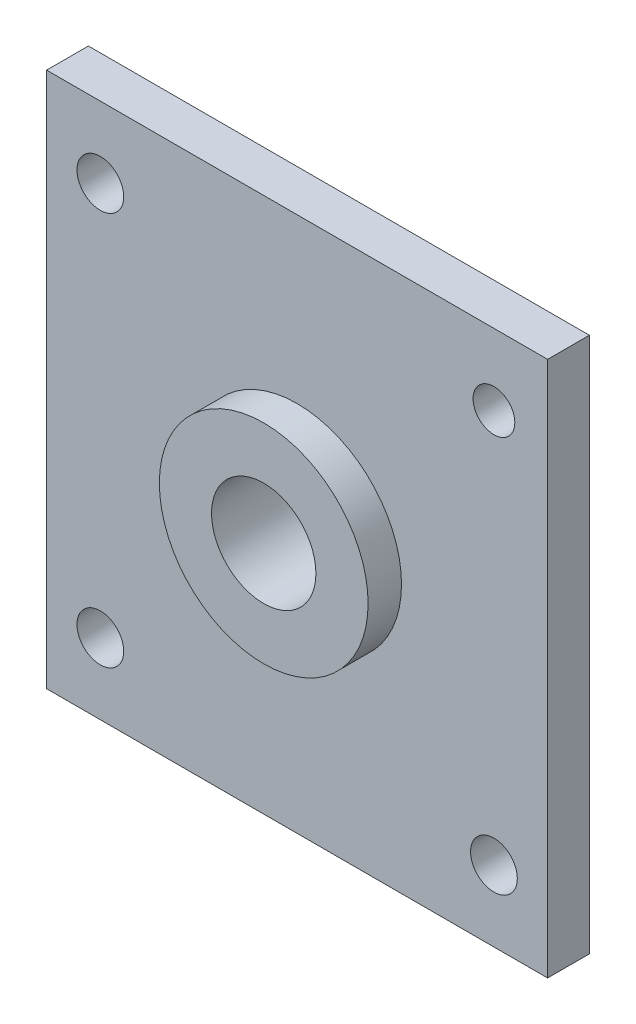
from build123d import *
from OCP.BRepFilletAPI import BRepFilletAPI_MakeChamfer

# Parameters (mm, degrees)
SKETCH_1_W               = 150
SKETCH_1_H               = 150
EXTRUDE_1_DEPTH          = 20
SKETCH_2_W               = 200
SKETCH_2_H               = 170
EXTRUDE_2_DEPTH          = 20
SKETCH_3_W               = 200
SKETCH_3_H               = 22.5
EXTRUDE_3_DEPTH          = 20
SKETCH_4_W               = 200
SKETCH_4_H               = 101.536616744
SKETCH_4_R               = 12
EXTRUDE_4_DEPTH          = 10
SKETCH_5_W               = 200
SKETCH_5_H               = 170
EXTRUDE_5_DEPTH          = 10
SKETCH_6_W               = 12.361111111
SKETCH_6_H               = 120
EXTRUDE_6_DEPTH          = 60
CHAMFER_1_SIZE           = 10
CHAMFER_1_SIZE2          = 12.546778674
SKETCH_8_R               = 12.5
CUT_EXTRUDE_1_DEPTH      = 200
SKETCH_9_R               = 5.6
CUT_EXTRUDE_2_DEPTH      = 200
FILLET_1_R               = 10
SKETCH_10_R              = 40
SKETCH_10_R_2            = 8.532995409
EXTRUDE_7_DEPTH          = 5
SKETCH_11_R              = 12.5
CUT_EXTRUDE_3_DEPTH      = 200
SKETCH_12_W              = 50
SKETCH_12_H              = 12.140710291
EXTRUDE_8_DEPTH          = 120
EXTRUDE_9_DEPTH          = 120
SKETCH_14_R              = 5
SKETCH_14_R_2            = 5.6
CUT_EXTRUDE_4_DEPTH      = 200
CUT_EXTRUDE_5_DEPTH      = 428.663313117
CUT_EXTRUDE_5_DEPTH_BACK = 428.663313117
SKETCH_16_W              = 64.88929467
SKETCH_16_H              = 154.650571828
SKETCH_17_R              = 25
SKETCH_17_R_2            = 12.5
EXTRUDE_11_DEPTH         = 8
RIB_1_REACH              = 411.018
SKETCH_18_WALL_W         = 895.028437604
SKETCH_18_WALL_H         = 15
CUT_EXTRUDE_6_DEPTH      = 428.663313117
CUT_EXTRUDE_6_DEPTH_BACK = 428.663313117
CUT_EXTRUDE_7_DEPTH      = 390.123413038
CUT_EXTRUDE_7_DEPTH_BACK = 390.123413038
SKETCH_20_W              = 77.763891656
SKETCH_20_H              = 49.195078016
CUT_EXTRUDE_8_DEPTH      = 361.312364484
CUT_EXTRUDE_8_DEPTH_BACK = 361.312364484
SKETCH_21_OUTSIDE_W      = 157.88
SKETCH_21_OUTSIDE_H      = 170.021
SKETCH_21_OUTSIDE_W_2    = 120.000001731
SKETCH_21_OUTSIDE_H_2    = 128.334009182
CUT_EXTRUDE_9_DEPTH      = 361.312364484
CUT_EXTRUDE_9_DEPTH_BACK = 361.312364484
SKETCH_22_R              = 12.5


with BuildPart() as part:
    # 草图1 → 凸台-拉伸1 (new body)
    with BuildSketch(Plane(origin=(0, 0, 0), x_dir=(1, 0, 0), z_dir=(0, 1, 0))):
        Rectangle(SKETCH_1_W, SKETCH_1_H)
    extrude(amount=EXTRUDE_1_DEPTH)

    # 草图2 → 凸台-拉伸2 (add)
    with BuildSketch(Plane(origin=(0, 20, 0), x_dir=(1, 0, 0), z_dir=(0, 1, 0))):
        with Locations((-25, 0)):
            Rectangle(SKETCH_2_W, SKETCH_2_H)
    extrude(amount=-EXTRUDE_2_DEPTH)

    # 草图3 → 凸台-拉伸3 (add)
    with BuildSketch(Plane(origin=(0, 20, 0), x_dir=(1, 0, 0), z_dir=(0, 1, 0))):
        with Locations((-25, -96.25)):
            Rectangle(SKETCH_3_W, SKETCH_3_H)
    extrude(amount=-EXTRUDE_3_DEPTH)

    # 草图4 → 凸台-拉伸4 (add)
    with BuildSketch(Plane(origin=(0, 20, 0), x_dir=(1, 0, 0), z_dir=(0, 1, 0))):
        with Locations((-25, -135.768308372)):
            Rectangle(SKETCH_4_W, SKETCH_4_H)
        with Locations(Location((35, -147.018308372, 0), (0, 0, 270))):
            Circle(SKETCH_4_R, mode=Mode.SUBTRACT)
        with Locations(Location((-85, -147.018308372, 0), (0, 0, 270))):
            Circle(SKETCH_4_R, mode=Mode.SUBTRACT)
    extrude(amount=EXTRUDE_4_DEPTH)

    # 草图5 → 凸台-拉伸5 (add)
    with BuildSketch(Plane(origin=(0, 20, 0), x_dir=(1, 0, 0), z_dir=(0, 1, 0))):
        with Locations((-25, 0)):
            Rectangle(SKETCH_5_W, SKETCH_5_H)
    extrude(amount=EXTRUDE_5_DEPTH)

    # 草图6 → 凸台-拉伸6 (add, symmetric)
    with BuildSketch(Plane(origin=(-25, 0, 0), x_dir=(0, 0, -1), z_dir=(1, 0, 0))):
        Polygon((-67.5, 30), (-5, 30), (-42.777777778, 230), (-67.5, 230), align=None)
        with Locations((-61.319444445, 290)):
            Rectangle(SKETCH_6_W, SKETCH_6_H)
    extrude(amount=EXTRUDE_6_DEPTH, both=True)

    # 倒角1: one chamfer whose edges measure the first distance from different faces: ONE call of the kernel's chamfer builder (chamfer() names one face for all edges)
    chamfer_1_edges_1 = [part.edges().sort_by_distance(p)[0] for p in [
        (-85, 30, 36.25),
        (-25, 30, 67.5),
        (35, 30, 36.25),
    ]]
    chamfer_1_edges_2 = [part.edges().sort_by_distance(p)[0] for p in [
        (-25, 30, 5),
    ]]
    chamfer_1_side_2 = [part.faces().sort_by_distance(p)[0] for p in [
        (-121.627580479, 30, 50.768308372),
    ]]
    chamfer_1 = BRepFilletAPI_MakeChamfer(part.part.solid().wrapped)
    for e in chamfer_1_edges_1:
        chamfer_1.Add(CHAMFER_1_SIZE, e.wrapped)
    for e in chamfer_1_edges_2:
        chamfer_1.Add(CHAMFER_1_SIZE, CHAMFER_1_SIZE2, e.wrapped, chamfer_1_side_2[0].wrapped)  # the first distance lies on this face
    add(Compound.cast(chamfer_1.Shape()), mode=Mode.REPLACE)

    # 草图8 → 切除-拉伸1 (cut)
    with BuildSketch(Plane.XY.offset(67.5)):
        with Locations((-25, 285.8)):
            Circle(SKETCH_8_R)
    extrude(amount=-CUT_EXTRUDE_1_DEPTH, mode=Mode.SUBTRACT)

    # 草图9 → 切除-拉伸2 (cut)
    with BuildSketch(Plane.XY.offset(67.5)):
        with Locations((-72.14, 333.54)):
            Circle(SKETCH_9_R)
        with Locations((-72.14, 239.26)):
            Circle(SKETCH_9_R)
        with Locations((22.14, 239.26)):
            Circle(SKETCH_9_R)
        with Locations((22.14, 333.54)):
            Circle(SKETCH_9_R)
    extrude(amount=-CUT_EXTRUDE_2_DEPTH, mode=Mode.SUBTRACT)

    # 圆角1
    fillet_1_edges = [part.edges().sort_by_distance(p)[0] for p in [
        (35, 350, 61.319444444),
        (-85, 350, 61.319444444),
    ]]
    fillet(fillet_1_edges, radius=FILLET_1_R)

    # 草图10 → 凸台-拉伸7 (add)
    with BuildSketch(Plane.XY.offset(67.5)):
        with Locations((-25, 285.8)):
            Circle(SKETCH_10_R)
        with Locations((-25, 285.8)):
            Circle(SKETCH_10_R_2, mode=Mode.SUBTRACT)
    extrude(amount=EXTRUDE_7_DEPTH)

    # 草图11 → 切除-拉伸3 (cut)
    with BuildSketch(Plane.XY.offset(72.5)):
        with Locations((-25, 285.8)):
            Circle(SKETCH_11_R)
    extrude(amount=-CUT_EXTRUDE_3_DEPTH, mode=Mode.SUBTRACT)

    # 草图12 → 凸台-拉伸8 (add)
    with BuildSketch(Plane(origin=(35, 0, 0), x_dir=(0, 0, -1), z_dir=(1, 0, 0))):
        with Locations((-67.777777778, 223.929644855)):
            Rectangle(SKETCH_12_W, SKETCH_12_H)
    extrude(amount=-EXTRUDE_8_DEPTH)

    # 草图13 → 凸台-拉伸9 (add)
    with BuildSketch(Plane(origin=(35, 0, 0), x_dir=(0, 0, -1), z_dir=(1, 0, 0))):
        Polygon((-92.777777778, 230), (-102.486640647, 230), (-102.486640647, 350), (-112.486640647, 350), (-112.486640647, 230), (-112.486640647, 217.859289709), (-92.777777778, 217.859289709), align=None)
    extrude(amount=-EXTRUDE_9_DEPTH)

    # 草图14 → 切除-拉伸4 (cut)
    with BuildSketch(Plane.XY.offset(112.486640647)):
        with Locations((22.14, 332.94)):
            Circle(SKETCH_14_R)
        with Locations((22.14, 238.66)):
            Circle(SKETCH_14_R_2)
        with Locations((-72.14, 238.66)):
            Circle(SKETCH_14_R_2)
        with Locations((-72.14, 332.94)):
            Circle(SKETCH_14_R_2)
    extrude(amount=-CUT_EXTRUDE_4_DEPTH, mode=Mode.SUBTRACT)

    # 草图16 → 切除-拉伸5 (cut, two sides: drawn at the far end of the back side and taken through both)
    with BuildSketch(Plane.ZY.offset(85).offset(-CUT_EXTRUDE_5_DEPTH_BACK)):
        with Locations((49.451016332, 307.325285914)):
            Rectangle(SKETCH_16_W, SKETCH_16_H)
    extrude(amount=CUT_EXTRUDE_5_DEPTH + CUT_EXTRUDE_5_DEPTH_BACK, mode=Mode.SUBTRACT)

    # 草图17 → 凸台-拉伸11 (add)
    with BuildSketch(Plane.XY.offset(112.486640647)):
        with Locations((-24.999999135, 285.832995409)):
            Circle(SKETCH_17_R)
        with Locations((-24.999999135, 285.832995409)):
            Circle(SKETCH_17_R_2, mode=Mode.SUBTRACT)
    extrude(amount=EXTRUDE_11_DEPTH)

    # 草图18 wall → 筋1 (add, up to next)
    with BuildSketch(Plane(origin=(-25, 187.859289709, 89.993320324), x_dir=(0, -0.800085500873, -0.599885981911), z_dir=(0, 0.599885981911, -0.800085500873)), mode=Mode.PRIVATE) as rib_1_sk1:
        Rectangle(SKETCH_18_WALL_W, SKETCH_18_WALL_H)
    rib_1_tool1 = extrude(rib_1_sk1.sketch, amount=RIB_1_REACH, mode=Mode.PRIVATE) - part.part
    add(rib_1_tool1.solids().sort_by_distance((-25, 187.859289709, 89.993320324))[0])

    # 草图19 → 切除-拉伸6 (cut, two sides: drawn at the far end of the back side and taken through both)
    with BuildSketch(Plane(origin=(35, 0, 0), x_dir=(0, 0, -1), z_dir=(1, 0, 0)).offset(-CUT_EXTRUDE_6_DEPTH_BACK)):
        Polygon((-112.486640647, 217.859289709), (203.167671069, 217.859289709), (203.167671069, -23.133322037), (-112.486640647, -23.133322037), (-240.759412705, -23.133322037), (-240.759412705, 217.859289709), align=None)
    extrude(amount=CUT_EXTRUDE_6_DEPTH + CUT_EXTRUDE_6_DEPTH_BACK, mode=Mode.SUBTRACT)

    # 草图20 → 切除-拉伸7 (cut, two sides: drawn at the far end of the back side and taken through both)
    with BuildSketch(Plane(origin=(35, 0, 0), x_dir=(0, 0, -1), z_dir=(1, 0, 0)).offset(-CUT_EXTRUDE_7_DEPTH_BACK)):
        with Locations((-63.604694819, 225.128578756)):
            Rectangle(SKETCH_20_W, SKETCH_20_H)
    extrude(amount=CUT_EXTRUDE_7_DEPTH + CUT_EXTRUDE_7_DEPTH_BACK, mode=Mode.SUBTRACT)

    # 草图21 outside → 切除-拉伸8 (cut, two sides: drawn at the far end of the back side and taken through both)
    with BuildSketch(Plane.XY.offset(112.486640647).offset(-CUT_EXTRUDE_8_DEPTH_BACK)):
        with Locations((-25, 283.9295)):
            Rectangle(SKETCH_21_OUTSIDE_W, SKETCH_21_OUTSIDE_H)
        with Locations((-24.999999134, 285.832995409)):
            Rectangle(SKETCH_21_OUTSIDE_W_2, SKETCH_21_OUTSIDE_H_2, mode=Mode.SUBTRACT)
    extrude(amount=CUT_EXTRUDE_8_DEPTH + CUT_EXTRUDE_8_DEPTH_BACK, mode=Mode.SUBTRACT)

    # 草图22 → 切除-拉伸9 (cut, two sides: drawn at the far end of the back side and taken through both)
    with BuildSketch(Plane.XY.offset(112.486640647).offset(-CUT_EXTRUDE_9_DEPTH_BACK)):
        with Locations((-24.999999135, 285.832995409)):
            Circle(SKETCH_22_R)
    extrude(amount=CUT_EXTRUDE_9_DEPTH + CUT_EXTRUDE_9_DEPTH_BACK, mode=Mode.SUBTRACT)


solid = part.part
